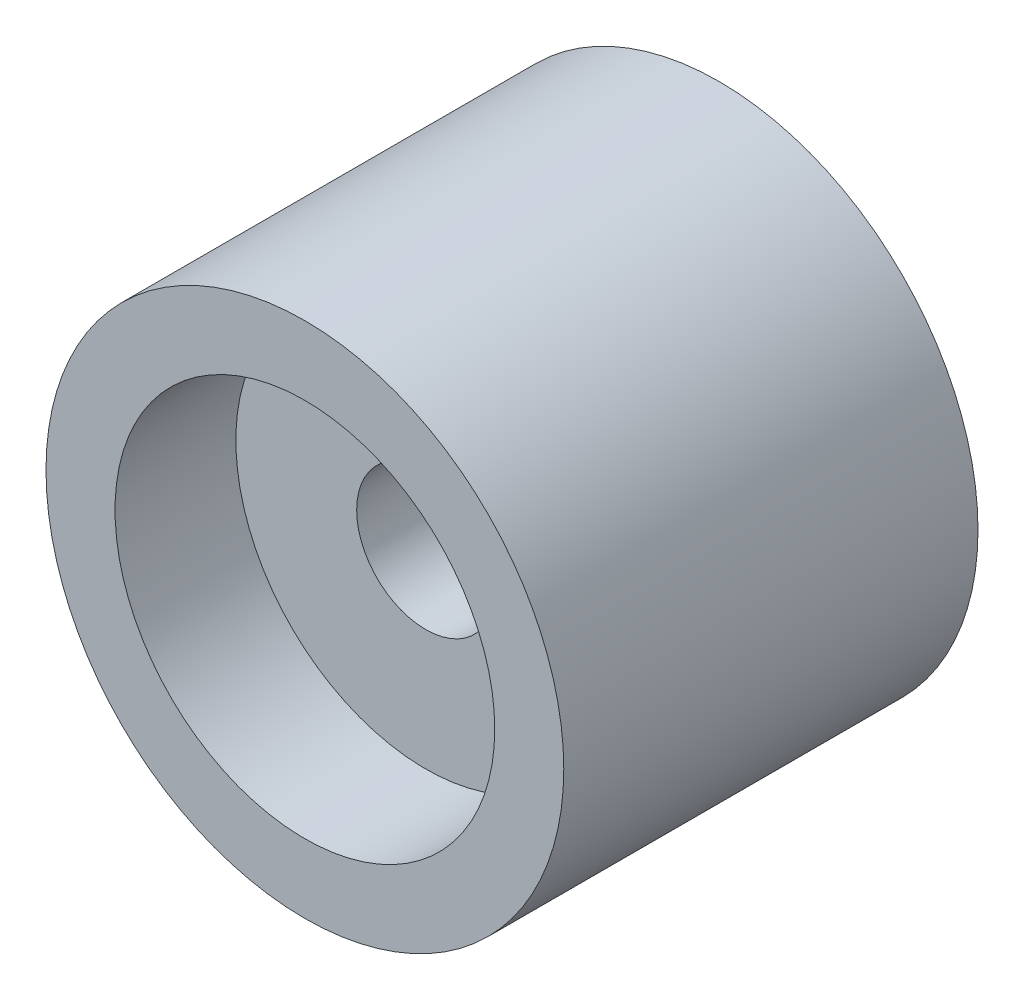
from build123d import *

# Parameters (mm, degrees)
SKETCH1_R          = 15
SKETCH1_R_2        = 4
EXTRUDE1_DEPTH     = 24
SKETCH2_R          = 11
CUT_EXTRUDE1_DEPTH = 7
CUT_EXTRUDE2_START = -7
SKETCH3_R          = 11
CUT_EXTRUDE2_DEPTH = 7


with BuildPart() as part:
    # Sketch1 → Extrude1 (new body)
    with BuildSketch(Plane.XY):
        Circle(SKETCH1_R)
        Circle(SKETCH1_R_2, mode=Mode.SUBTRACT)
    extrude(amount=EXTRUDE1_DEPTH)

    # Sketch2 → Cut-Extrude1 (cut)
    with BuildSketch(Plane.XY.offset(24)):
        Circle(SKETCH2_R)
    extrude(amount=-CUT_EXTRUDE1_DEPTH, mode=Mode.SUBTRACT)

    # Sketch3 → Cut-Extrude2 (cut)
    with BuildSketch(Plane(origin=(0, 0, 0), x_dir=(-1, 0, 0), z_dir=(0, 0, -1)).offset(CUT_EXTRUDE2_START)):
        with Locations(Location((0, 0, 0), (0, 0, 180))):
            Circle(SKETCH3_R)
    extrude(amount=CUT_EXTRUDE2_DEPTH, mode=Mode.SUBTRACT)


solid = part.part
